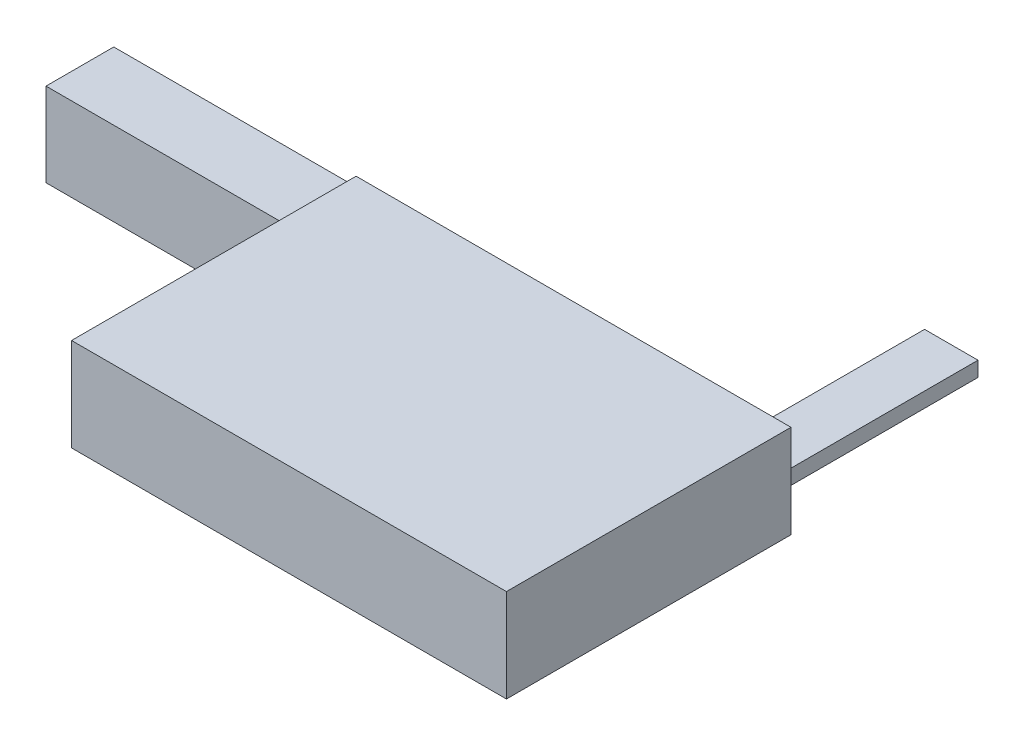
from build123d import *

# Parameters (mm, degrees)
SKETCH_1_W      = 88.3
SKETCH_1_H      = 57.77
EXTRUDE_1_DEPTH = 18.9
SKETCH_2_W      = 13.76
SKETCH_2_H      = 17
EXTRUDE_2_DEPTH = 48
SKETCH_3_W      = 10.848746397
SKETCH_3_H      = 3.037648992
EXTRUDE_3_DEPTH = 45


with BuildPart() as part:
    # Эскиз1 → Бобышка-Вытянуть1 (new body)
    with BuildSketch(Plane(origin=(0, 0, 0), x_dir=(1, 0, 0), z_dir=(0, 1, 0))):
        with Locations((-24.816331195, -7.343762185)):
            Rectangle(SKETCH_1_W, SKETCH_1_H)
    extrude(amount=EXTRUDE_1_DEPTH)

    # Эскиз2 → Бобышка-Вытянуть2 (add)
    with BuildSketch(Plane.ZY.offset(68.966331195)):
        with Locations((-13.462732009, 9.722786208)):
            Rectangle(SKETCH_2_W, SKETCH_2_H)
    extrude(amount=EXTRUDE_2_DEPTH)

    # Эскиз3 → Бобышка-Вытянуть3 (add)
    with BuildSketch(Plane(origin=(0, 0, -21.541237815), x_dir=(-1, 0, 0), z_dir=(0, 0, -1))):
        with Locations((-6.878820548, 3.164454924)):
            Rectangle(SKETCH_3_W, SKETCH_3_H)
    extrude(amount=EXTRUDE_3_DEPTH)


solid = part.part
